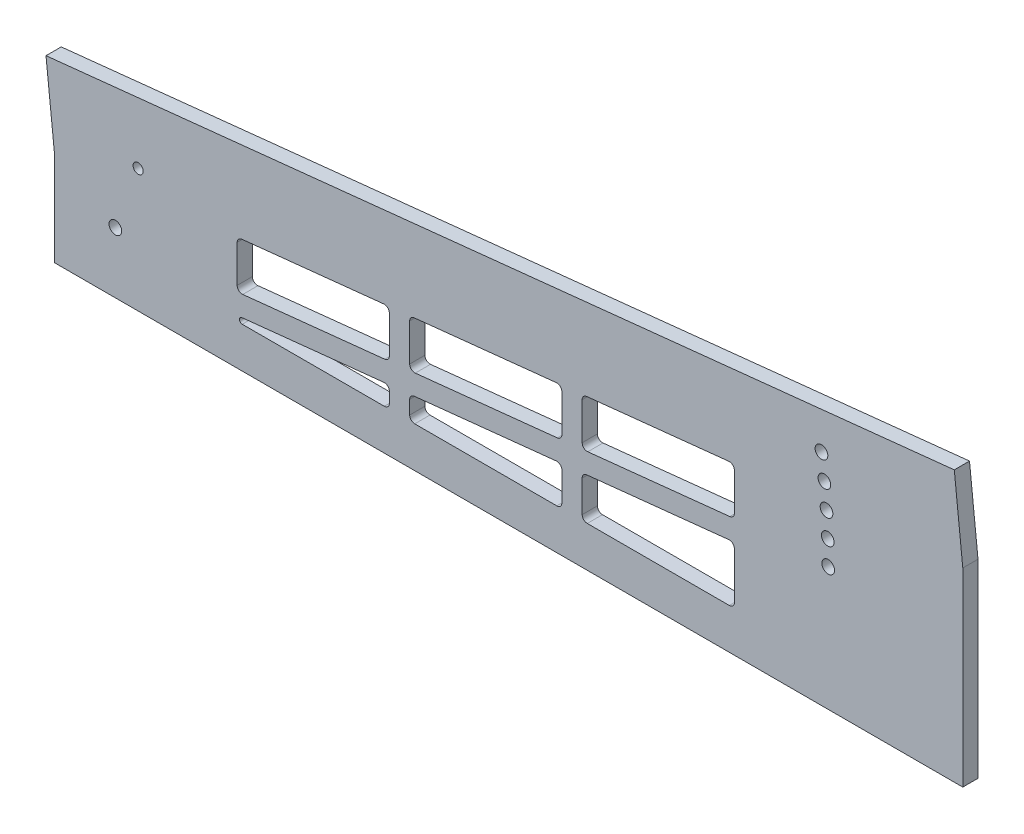
from build123d import *

# Parameters (mm, degrees)
BOSS_EXTRUDE1_DEPTH = 19.05
SKETCH8_R           = 6.35
CUT_EXTRUDE3_DEPTH  = 1187.240784438
SKETCH10_R          = 7.9375
CUT_EXTRUDE5_DEPTH  = 1187.240784438
CUT_EXTRUDE6_DEPTH  = 1187.240784438
SKETCH13_R          = 7.9375
CUT_EXTRUDE7_DEPTH  = 1187.240784438


with BuildPart() as part:
    # Sketch1 → Boss-Extrude1 (new body)
    with BuildSketch(Plane.XY):
        Polygon((-10.620091868, 219.094223225), (1126.118434538, 338.57025674), (1136.738526406, 237.526832171), (1136.738526406, 0), (0, 0), (0, 118.050798656), align=None)
    extrude(amount=BOSS_EXTRUDE1_DEPTH)

    # Sketch8 → Cut-Extrude3 (cut, through all)
    with BuildSketch(Plane.XY.offset(19.05)):
        with Locations((104.703615638, 154.595502408)):
            Circle(SKETCH8_R)
    extrude(amount=-CUT_EXTRUDE3_DEPTH, mode=Mode.SUBTRACT)

    # Sketch10 → Cut-Extrude5 (cut, through all)
    with BuildSketch(Plane.XY.offset(19.05)):
        with Locations((963.572724478, 244.866283286)):
            Circle(SKETCH10_R)
        with Locations((966.199929442, 214.837193133)):
            Circle(SKETCH10_R)
        with Locations((967.777533852, 184.73470776)):
            Circle(SKETCH10_R)
        with Locations((968.303615638, 154.595502408)):
            Circle(SKETCH10_R)
        with Locations((959.899119803, 274.785392397)):
            Circle(SKETCH10_R)
    extrude(amount=-CUT_EXTRUDE5_DEPTH, mode=Mode.SUBTRACT)

    # Sketch12 → Cut-Extrude6 (cut, through all)
    with BuildSketch(Plane.XY.offset(19.05)):
        with BuildLine():
            Line((844.55, 50.8), (666.75, 50.8))
            ThreePointArc((666.75, 50.8), (662.259871939, 52.659871939), (660.4, 57.15))
            Line((660.4, 57.15), (660.4, 96.816443106))
            ThreePointArc((660.4, 96.816443106), (662.031030358, 101.065422457), (666.086244258, 103.131657142))
            Line((666.086244258, 103.131657142), (843.886244258, 121.819190172))
            ThreePointArc((843.886244258, 121.819190172), (848.79897935, 120.222945778), (850.9, 115.503976137))
            Line((850.9, 115.503976137), (850.9, 57.15))
            ThreePointArc((850.9, 57.15), (849.040128061, 52.659871939), (844.55, 50.8))
        make_face()
        with BuildLine():
            Line((444.5, 57.15), (444.5, 74.124438713))
            ThreePointArc((444.5, 74.124438713), (446.131030358, 78.373418063), (450.186244258, 80.439652748))
            Line((450.186244258, 80.439652748), (627.986244258, 99.127185778))
            ThreePointArc((627.986244258, 99.127185778), (632.89897935, 97.530941385), (635, 92.811971743))
            Line((635, 92.811971743), (635, 57.15))
            ThreePointArc((635, 57.15), (633.140128061, 52.659871939), (628.65, 50.8))
            Line((628.65, 50.8), (450.85, 50.8))
            ThreePointArc((450.85, 50.8), (446.359871939, 52.659871939), (444.5, 57.15))
        make_face()
        with BuildLine():
            Line((843.886244258, 206.74681701), (666.086244258, 188.05928398))
            ThreePointArc((666.086244258, 188.05928398), (662.031030358, 185.993049294), (660.4, 181.744069944))
            Line((660.4, 181.744069944), (660.4, 135.126308558))
            ThreePointArc((660.4, 135.126308558), (662.50102065, 130.407338916), (667.413755742, 128.811094522))
            Line((667.413755742, 128.811094522), (845.213755742, 147.498627552))
            ThreePointArc((845.213755742, 147.498627552), (849.268969642, 149.564862238), (850.9, 153.813841588))
            Line((850.9, 153.813841588), (850.9, 200.431602974))
            ThreePointArc((850.9, 200.431602974), (848.79897935, 205.150572616), (843.886244258, 206.74681701))
        make_face()
        with BuildLine():
            Line((627.986244258, 184.054812616), (450.186244258, 165.367279586))
            ThreePointArc((450.186244258, 165.367279586), (446.131030358, 163.301044901), (444.5, 159.05206555))
            Line((444.5, 159.05206555), (444.5, 112.434304164))
            ThreePointArc((444.5, 112.434304164), (446.60102065, 107.715334522), (451.513755742, 106.119090128))
            Line((451.513755742, 106.119090128), (629.313755742, 124.806623159))
            ThreePointArc((629.313755742, 124.806623159), (633.368969642, 126.872857844), (635, 131.121837194))
            Line((635, 131.121837194), (635, 177.73959858))
            ThreePointArc((635, 177.73959858), (632.89897935, 182.458568222), (627.986244258, 184.054812616))
        make_face()
        with BuildLine():
            Line((412.75, 50.8), (234.95, 50.8))
            ThreePointArc((234.95, 50.8), (231.455726331, 54.115941899), (234.584247692, 57.778969777))
            Line((234.584247692, 57.778969777), (412.086244258, 76.435181385))
            ThreePointArc((412.086244258, 76.435181385), (416.99897935, 74.838936991), (419.1, 70.119967349))
            Line((419.1, 70.119967349), (419.1, 57.15))
            ThreePointArc((419.1, 57.15), (417.240128061, 52.659871939), (412.75, 50.8))
        make_face()
        with BuildLine():
            Line((234.286244258, 142.675275192), (412.086244258, 161.362808222))
            ThreePointArc((412.086244258, 161.362808222), (416.99897935, 159.766563828), (419.1, 155.047594187))
            Line((419.1, 155.047594187), (419.1, 108.4298328))
            ThreePointArc((419.1, 108.4298328), (417.468969642, 104.18085345), (413.413755742, 102.114618765))
            Line((413.413755742, 102.114618765), (235.613755742, 83.427085734))
            ThreePointArc((235.613755742, 83.427085734), (230.70102065, 85.023330128), (228.6, 89.74229977))
            Line((228.6, 89.74229977), (228.6, 136.360061156))
            ThreePointArc((228.6, 136.360061156), (230.231030358, 140.609040507), (234.286244258, 142.675275192))
        make_face()
    extrude(amount=-CUT_EXTRUDE6_DEPTH, mode=Mode.SUBTRACT)

    # Sketch13 → Cut-Extrude7 (cut, through all)
    with BuildSketch(Plane.XY.offset(19.05)):
        with Locations((76.2, 76.2)):
            Circle(SKETCH13_R)
    extrude(amount=-CUT_EXTRUDE7_DEPTH, mode=Mode.SUBTRACT)


solid = part.part
